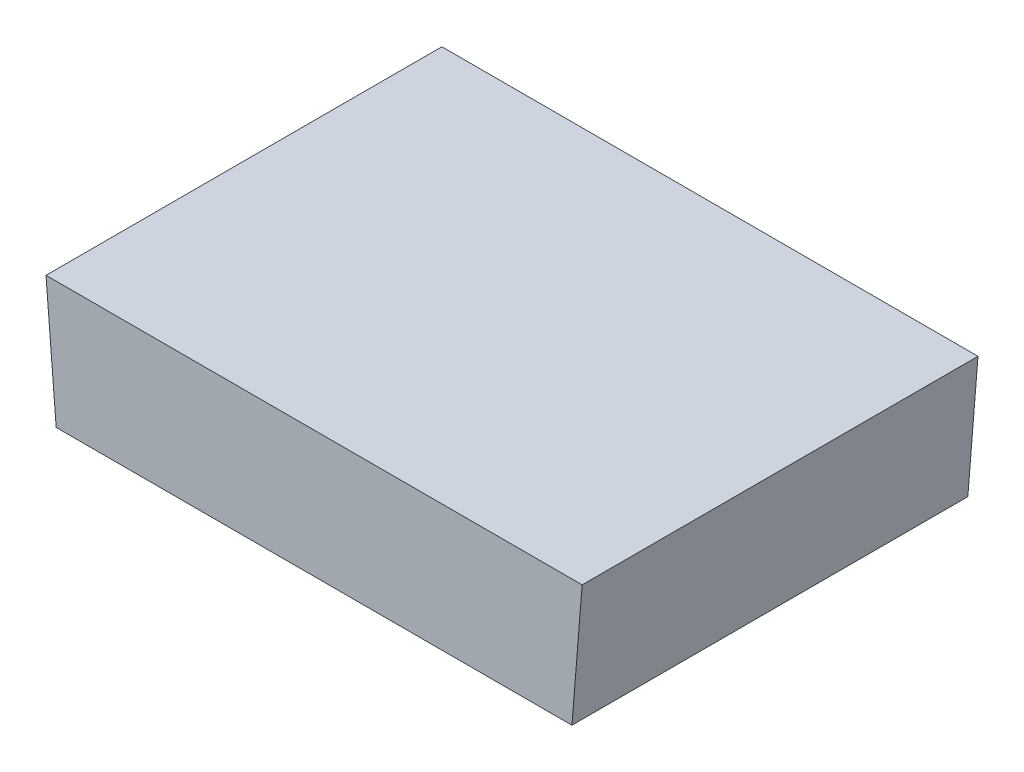
from build123d import *

# Parameters (mm, degrees)
BOSS_EXTRUDE1_DEPTH = 69.453125
SKETCH3_R           = 6.05234375
BOSS_EXTRUDE2_DEPTH = 3.175


with BuildPart() as part:
    # Sketch2 → Boss-Extrude1 (new body)
    with BuildSketch(Plane.XY):
        Polygon((45.24375, -11.988978873), (-45.24375, -11.988978873), (-47.0296875, 10.236021127), (47.0296875, 10.236021127), align=None)
    extrude(amount=BOSS_EXTRUDE1_DEPTH)

    # Sketch3 → Boss-Extrude2 (add)
    with BuildSketch(Plane.XZ.offset(11.988978873)):
        with Locations((36.01640625, 10.42590625)):
            Circle(SKETCH3_R)
        with Locations((-36.01640625, 9.22734375)):
            Circle(SKETCH3_R)
        with Locations((-36.01640625, 57.24921875)):
            Circle(SKETCH3_R)
        with Locations((36.01640625, 58.44778125)):
            Circle(SKETCH3_R)
        with BuildLine():
            Line((23.893870965, 33.420622184), (23.893870965, 38.778434684))
            ThreePointArc((23.893870965, 38.778434684), (29.152464715, 44.037028434), (34.411058465, 38.778434684))
            Line((34.411058465, 38.778434684), (34.411058465, 33.420622184))
            ThreePointArc((34.411058465, 33.420622184), (29.152464715, 28.162028434), (23.893870965, 33.420622184))
        make_face()
        with BuildLine():
            Line((-33.180557656, 32.453258987), (-33.180557656, 37.811071487))
            ThreePointArc((-33.180557656, 37.811071487), (-27.921963906, 43.069665237), (-22.663370156, 37.811071487))
            Line((-22.663370156, 37.811071487), (-22.663370156, 32.453258987))
            ThreePointArc((-22.663370156, 32.453258987), (-27.921963906, 27.194665237), (-33.180557656, 32.453258987))
        make_face()
    extrude(amount=BOSS_EXTRUDE2_DEPTH)


solid = part.part
